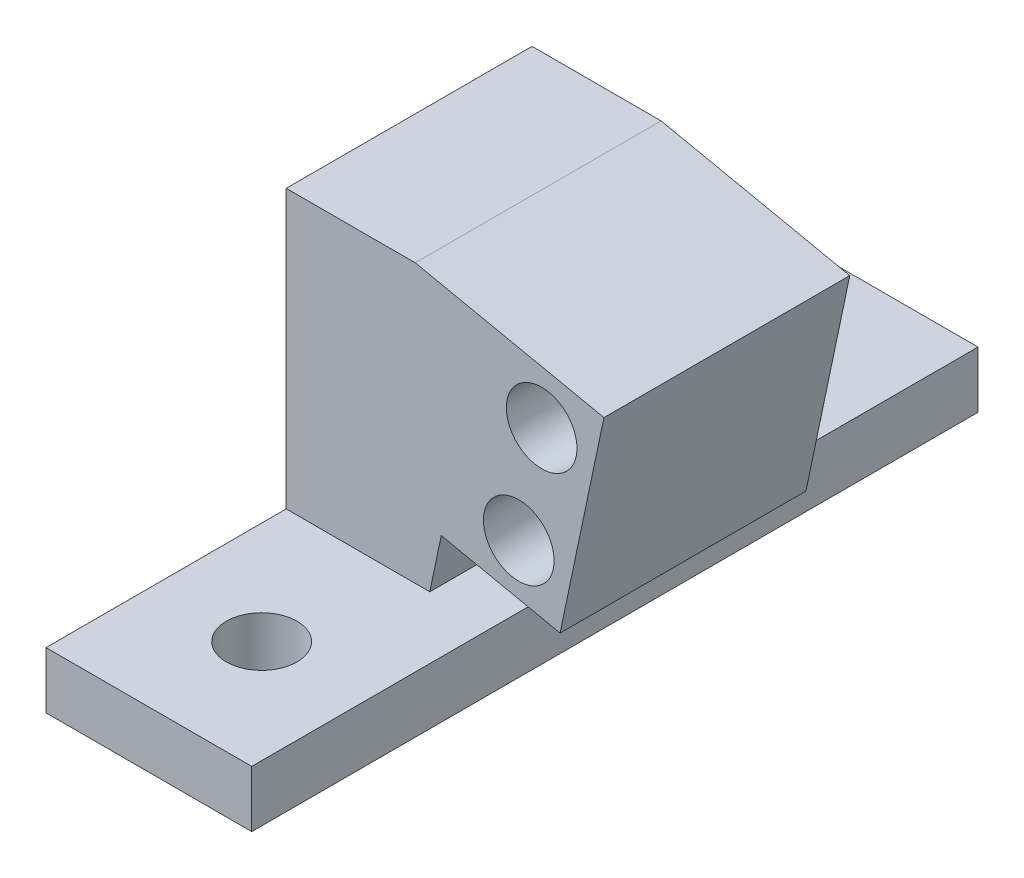
from build123d import *

# Parameters (mm, degrees)
SKETCH2_R           = 3.175
BOSS_EXTRUDE1_DEPTH = 22.098
SKETCH3_W           = 6.414942463
SKETCH3_H           = 22.098
BOSS_EXTRUDE2_DEPTH = 6.35
SKETCH5_W           = 18.491886748
SKETCH5_H           = 65.278
SKETCH5_R           = 3.175
BOSS_EXTRUDE4_DEPTH = 5.08
BOSS_EXTRUDE7_REACH = 239.969
SKETCH7_W           = 22.098
SKETCH7_H           = 24.955967439


with BuildPart() as part:
    # Sketch2 → Boss-Extrude1 (new body)
    with BuildSketch(Plane.XY):
        Polygon((-633.396746705, 209.866473294), (-629.456250373, 228.608305414), (-646.417262265, 232.174381811), (-650.357758597, 213.432549691), align=None)
        with Locations(Location((-637.11116423, 215.213960129, 0), (0, 0, 180))):
            Circle(SKETCH2_R, mode=Mode.SUBTRACT)
        with Locations(Location((-635.053635704, 225, 0), (0, 0, 180))):
            Circle(SKETCH2_R, mode=Mode.SUBTRACT)
    extrude(amount=BOSS_EXTRUDE1_DEPTH)

    # Sketch3 → Boss-Extrude2 (add)
    with BuildSketch(Plane(origin=(15.442364745, 73.44714554, 0), x_dir=(0.9786039871389689, -0.20575285260650172, 0), z_dir=(-0.20575285260650172, -0.9786039871389689, 0))):
        with Locations((-677.149580337, 11.049)):
            Rectangle(SKETCH3_W, SKETCH3_H)
    extrude(amount=BOSS_EXTRUDE2_DEPTH)

    # Sketch5 → Boss-Extrude4 (add)
    with BuildSketch(Plane(origin=(0, 207.218414372, 0), x_dir=(1, 0, 0), z_dir=(0, 1, 0))):
        with Locations((-648.768345837, -11.049)):
            Rectangle(SKETCH5_W, SKETCH5_H)
        with Locations(Location((-648.793402463, -33.528, 0), (0, 0, 270))):
            Circle(SKETCH5_R, mode=Mode.SUBTRACT)
        with Locations(Location((-648.793402463, 11.43, 0), (0, 0, 270))):
            Circle(SKETCH5_R, mode=Mode.SUBTRACT)
    extrude(amount=-BOSS_EXTRUDE4_DEPTH)

    # Boss-Extrude7: up to this face of the body (flat: up to its plane)
    boss_extrude7_end = Plane(part.part.faces().sort_by_distance((-649.040775738, 219.696398091, 11.049))[0])
    # Sketch7 → Boss-Extrude7 (add, up to the picked face)
    with BuildSketch(Plane.ZY.offset(658.014289211), mode=Mode.PRIVATE) as boss_extrude7_sk1:
        with Locations((11.049, 219.696398092)):
            Rectangle(SKETCH7_W, SKETCH7_H)
    boss_extrude7_tool1 = split(extrude(boss_extrude7_sk1.sketch, amount=-BOSS_EXTRUDE7_REACH, mode=Mode.PRIVATE), bisect_by=boss_extrude7_end, keep=Keep.BOTH, mode=Mode.PRIVATE)
    add(boss_extrude7_tool1.solids().sort_by(Axis((-658.014289, 219.696398, 11.049), (1, 0, 0)))[0])


solid = part.part
